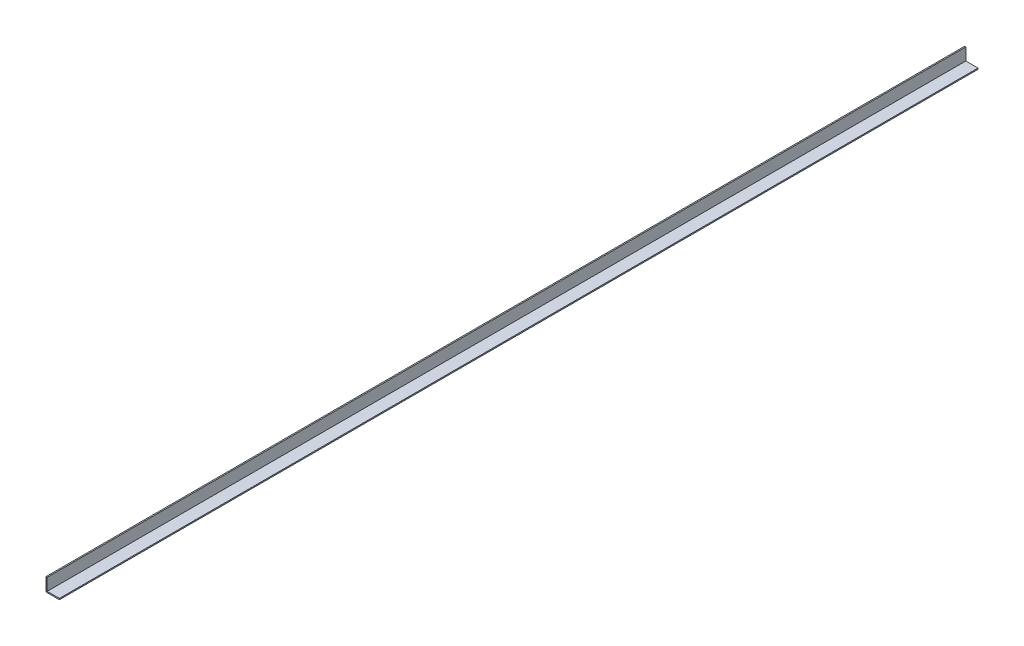
from build123d import *

# Parameters (mm, degrees)
SALIENTE_EXTRUIR1_DEPTH = 6100


with BuildPart() as part:
    # Croquis1 → Saliente-Extruir1 (new body)
    with BuildSketch(Plane.XY):
        Polygon((0, 88.9), (0, 0), (88.9, 0), (88.9, 7.94), (7.94, 7.94), (7.94, 88.9), align=None)
    extrude(amount=-SALIENTE_EXTRUIR1_DEPTH)


solid = part.part
